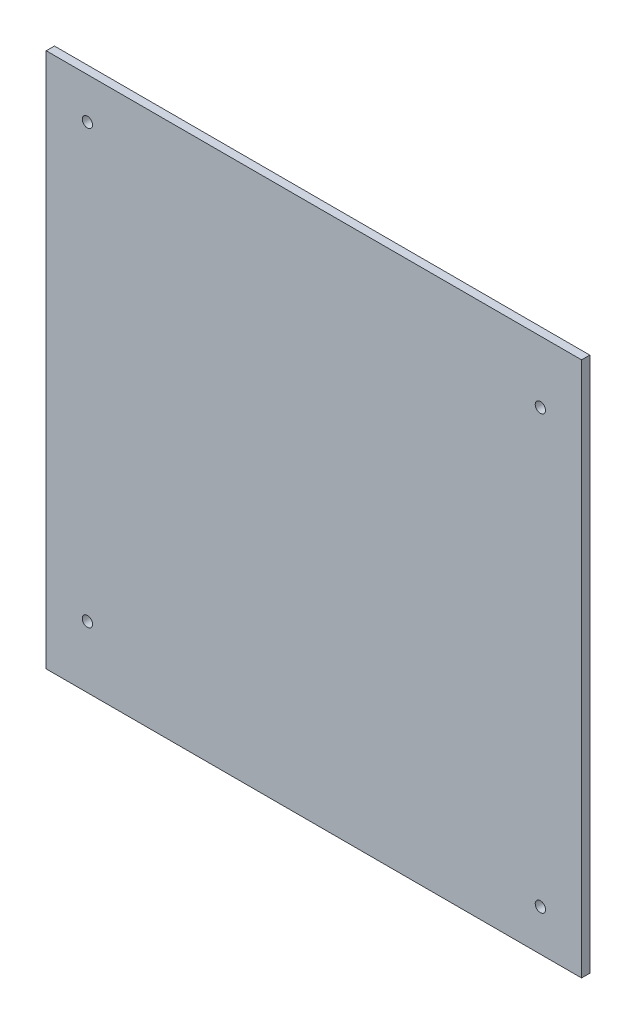
from build123d import *

# Parameters (mm, degrees)
SKETCH_1_W      = 130
SKETCH_1_H      = 130
SKETCH_1_R      = 1.25
EXTRUDE_1_DEPTH = 2


with BuildPart() as part:
    # Эскиз1 → Бобышка-Вытянуть1 (new body)
    with BuildSketch(Plane.XY):
        Rectangle(SKETCH_1_W, SKETCH_1_H)
        with Locations((-55, 55)):
            Circle(SKETCH_1_R, mode=Mode.SUBTRACT)
        with Locations((55, 50)):
            Circle(SKETCH_1_R, mode=Mode.SUBTRACT)
        with Locations((55, -55)):
            Circle(SKETCH_1_R, mode=Mode.SUBTRACT)
        with Locations((-55, -50)):
            Circle(SKETCH_1_R, mode=Mode.SUBTRACT)
    extrude(amount=EXTRUDE_1_DEPTH)


solid = part.part
